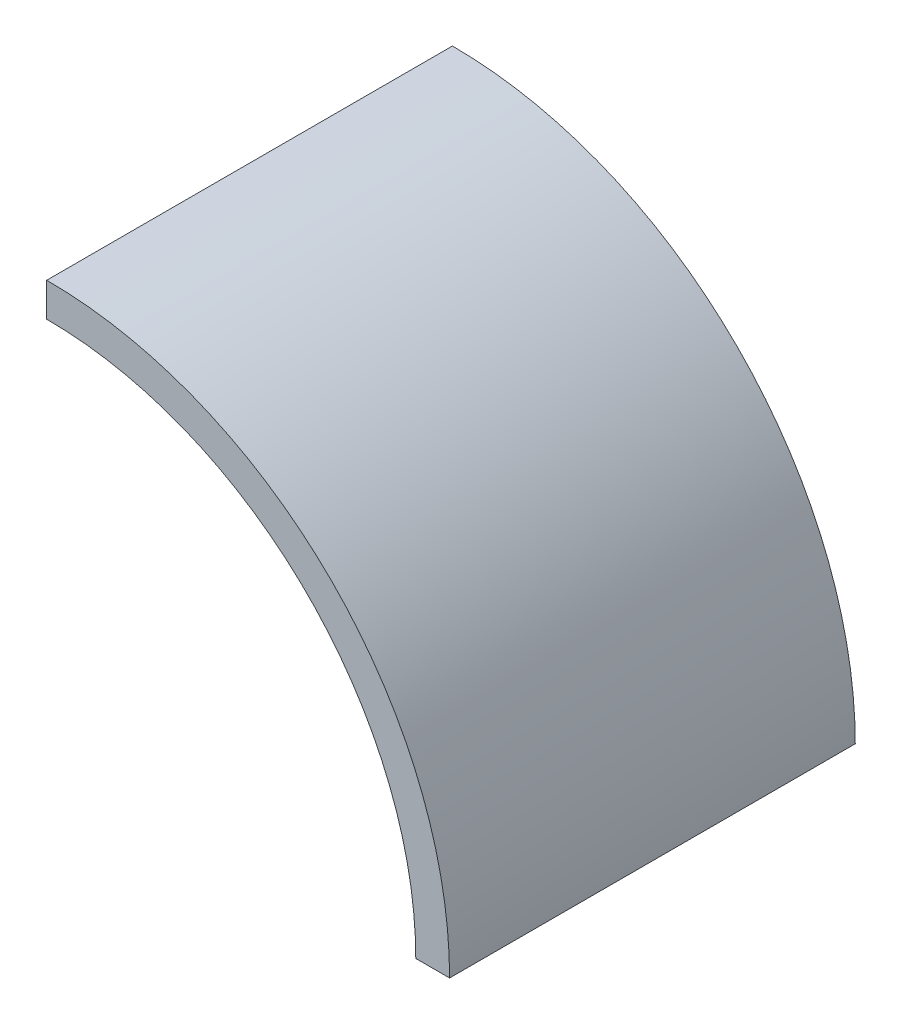
from build123d import *

# Parameters (mm, degrees)
Y_KSEKLIK_EKSTR_ZYON1_DEPTH = 18


with BuildPart() as part:
    # Çizim1 → Yükseklik-Ekstrüzyon1 (new body)
    with BuildSketch(Plane.XY):
        with BuildLine():
            Line((0, 17.875), (0, 16.375))
            ThreePointArc((0, 16.375), (11.578873542, 11.578873542), (16.375, 0))
            Line((16.375, 0), (17.875, 0))
            ThreePointArc((17.875, 0), (12.639533714, 12.639533714), (0, 17.875))
        make_face()
    extrude(amount=Y_KSEKLIK_EKSTR_ZYON1_DEPTH)


solid = part.part
